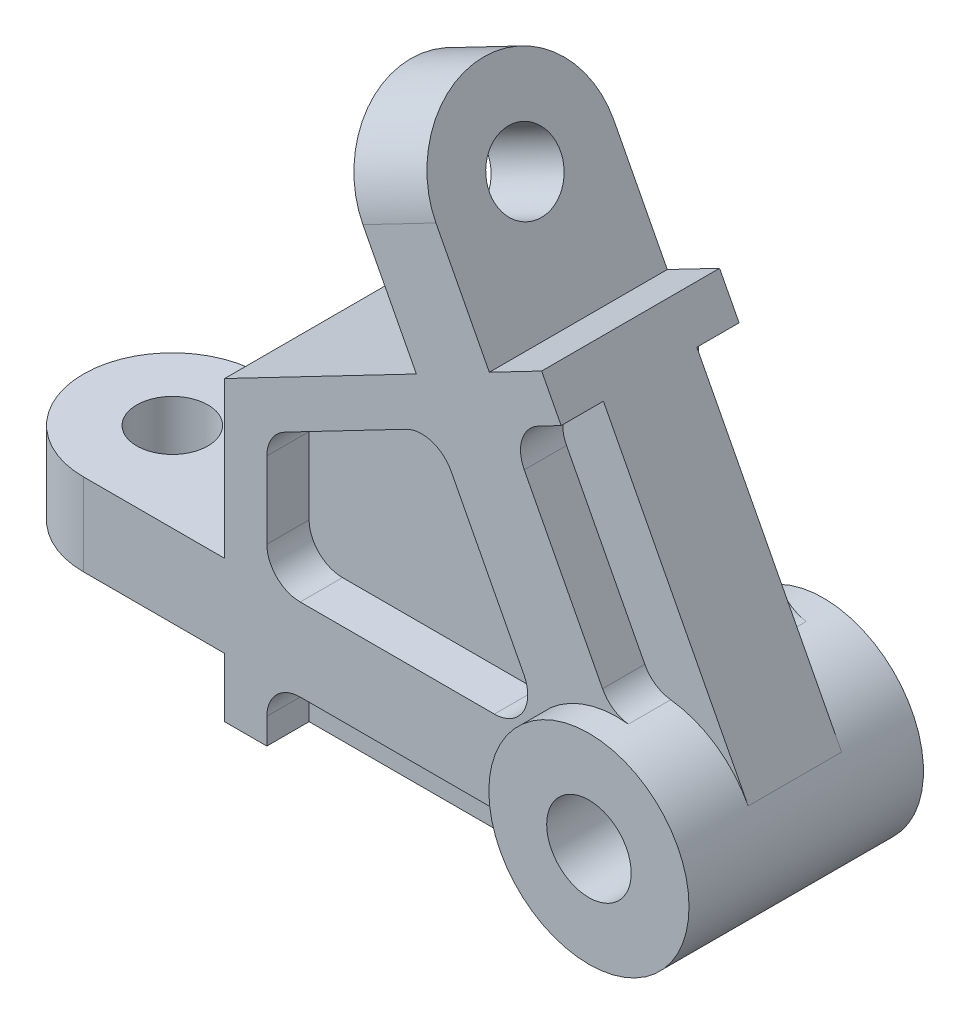
from build123d import *

# Parameters (mm, degrees)
BOSS_EXTRU_1_DEPTH      = 40
ESQUISSE2_R             = 8
ENL_V_MAT_EXTRU_1_DEPTH = 190.883457354
ESQUISSE3_R             = 8
ENL_V_MAT_EXTRU_2_DEPTH = 181.562836456
BOSS_EXTRU_2_DEPTH      = 6.35
BOSS_EXTRU_3_START      = 6.35
BOSS_EXTRU_3_DEPTH      = 6.35
ENL_V_START             = -9.5
ENL_V_MAT_EXTRU_3_DEPTH = 9.5
ENL_V_MAT_EXTRU_6_DEPTH = 9.5


with BuildPart() as part:
    # Esquisse1 → Boss.-Extru.1 (new body)
    with BuildSketch(Plane.XY):
        with BuildLine():
            ThreePointArc((-10.389343798, 19.957743747), (6.765880489, 21.458631392), (19.957743747, 10.389343798))
            Line((19.957743747, 10.389343798), (-16.981934979, 81.349806406))
            Line((-16.981934979, 81.349806406), (-28.734828519, 75.231637281))
            Line((-28.734828519, 75.231637281), (-49.975475061, 116.034539653))
            Line((-49.975475061, 116.034539653), (-58.180325268, 111.76336498))
            Line((-58.180325268, 111.76336498), (-10.389343798, 19.957743747))
        make_face()
        with BuildLine():
            ThreePointArc((-22.5, 0), (-19.23551709, 11.672398309), (-10.389343798, 19.957743747))
            Line((-10.389343798, 19.957743747), (-58.180325268, 111.76336498))
            Line((-58.180325268, 111.76336498), (-66.385175475, 107.492190308))
            Line((-66.385175475, 107.492190308), (-45.144528933, 66.689287936))
            Line((-45.144528933, 66.689287936), (-88.25, 44.25))
            Line((-88.25, 44.25), (-88.25, 9.25))
            Line((-88.25, 9.25), (-140, 9.25))
            Line((-140, 9.25), (-140, 0))
            Line((-140, 0), (-22.5, 0))
        make_face()
        with BuildLine():
            Line((-88.25, -22.560492565), (0.015421683, -22.499994715))
            ThreePointArc((0.015421683, -22.499994715), (-15.904449254, -15.915354031), (-22.5, 0))
            Line((-22.5, 0), (-140, 0))
            Line((-140, 0), (-140, -9.25))
            Line((-140, -9.25), (-88.25, -9.25))
            Line((-88.25, -9.25), (-88.25, -22.560492565))
        make_face()
        with BuildLine():
            ThreePointArc((22.5, 0), (21.855196571, 5.347932577), (19.957743747, 10.389343798))
            ThreePointArc((19.957743747, 10.389343798), (6.765880489, 21.458631392), (-10.389343798, 19.957743747))
            Line((-10.389343798, 19.957743747), (-4.386611826, 8.426602915))
            ThreePointArc((-4.386611826, 8.426602915), (4.928345953, 8.121662771), (9.5, 0))
            ThreePointArc((9.5, 0), (0, -9.5), (-9.5, 0))
            Line((-9.5, 0), (-22.5, 0))
            ThreePointArc((-22.5, 0), (-15.904449254, -15.915354031), (0.015421683, -22.499994715))
            ThreePointArc((0.015421683, -22.499994715), (15.915354031, -15.904449254), (22.5, 0))
        make_face()
        with BuildLine():
            Line((-4.386611826, 8.426602915), (-10.389343798, 19.957743747))
            ThreePointArc((-10.389343798, 19.957743747), (-19.23551709, 11.672398309), (-22.5, 0))
            Line((-22.5, 0), (-9.5, 0))
            ThreePointArc((-9.5, 0), (-8.121662771, 4.928345953), (-4.386611826, 8.426602915))
        make_face()
        with BuildLine():
            ThreePointArc((22.5, 0), (21.855196571, 5.347932577), (19.957743747, 10.389343798))
            ThreePointArc((19.957743747, 10.389343798), (6.765880489, 21.458631392), (-10.389343798, 19.957743747))
            Line((-10.389343798, 19.957743747), (-4.386611826, 8.426602915))
            ThreePointArc((-4.386611826, 8.426602915), (4.928345953, 8.121662771), (9.5, 0))
            ThreePointArc((9.5, 0), (0, -9.5), (-9.5, 0))
            Line((-9.5, 0), (-22.5, 0))
            ThreePointArc((-22.5, 0), (-15.904449254, -15.915354031), (0.015421683, -22.499994715))
            ThreePointArc((0.015421683, -22.499994715), (15.915354031, -15.904449254), (22.5, 0))
        make_face()
        with BuildLine():
            Line((-4.386611826, 8.426602915), (-10.389343798, 19.957743747))
            ThreePointArc((-10.389343798, 19.957743747), (-19.23551709, 11.672398309), (-22.5, 0))
            Line((-22.5, 0), (-9.5, 0))
            ThreePointArc((-9.5, 0), (-8.121662771, 4.928345953), (-4.386611826, 8.426602915))
        make_face()
    extrude(amount=BOSS_EXTRU_1_DEPTH)

    # Esquisse2 → Enlèv. mat.-Extru.1 (cut, through all)
    with BuildSketch(Plane(origin=(8.204850207, 4.271174672, 0), x_dir=(0, 0, -1), z_dir=(0.8870108331782228, 0.4617486132350319, 0))):
        with Locations(Location((-20, 106, 0), (0, 0, 90))):
            Circle(ESQUISSE2_R)
        with BuildLine():
            ThreePointArc((-40, 106), (-34.142135624, 120.142135624), (-20, 126))
            Line((-20, 126), (-40, 126))
            Line((-40, 126), (-40, 106))
        make_face()
        with BuildLine():
            ThreePointArc((-20, 126), (-5.857864376, 120.142135624), (0, 106))
            Line((0, 106), (0, 126))
            Line((0, 126), (-20, 126))
        make_face()
    extrude(amount=-ENL_V_MAT_EXTRU_1_DEPTH, mode=Mode.SUBTRACT)

    # Esquisse3 → Enlèv. mat.-Extru.2 (cut, through all)
    with BuildSketch(Plane(origin=(0, 9.25, 0), x_dir=(1, 0, 0), z_dir=(0, 1, 0))):
        with BuildLine():
            ThreePointArc((-140, -20), (-134.142135624, -5.857864376), (-120, 0))
            Line((-120, 0), (-140, 0))
            Line((-140, 0), (-140, -20))
        make_face()
        with BuildLine():
            ThreePointArc((-120, -40), (-134.142135624, -34.142135624), (-140, -20))
            Line((-140, -20), (-140, -40))
            Line((-140, -40), (-120, -40))
        make_face()
        with Locations(Location((-120, -20, 0), (0, 0, 180))):
            Circle(ESQUISSE3_R)
    extrude(amount=-ENL_V_MAT_EXTRU_2_DEPTH, mode=Mode.SUBTRACT)

    # Esquisse4 → Boss.-Extru.2 (add)
    with BuildSketch(Plane.XY.offset(40)):
        with BuildLine():
            ThreePointArc((22.5, 0), (21.855196571, 5.347932577), (19.957743747, 10.389343798))
            ThreePointArc((19.957743747, 10.389343798), (6.765880489, 21.458631392), (-10.389343798, 19.957743747))
            Line((-10.389343798, 19.957743747), (-4.386611826, 8.426602915))
            ThreePointArc((-4.386611826, 8.426602915), (4.928345953, 8.121662771), (9.5, 0))
            ThreePointArc((9.5, 0), (0, -9.5), (-9.5, 0))
            Line((-9.5, 0), (-22.5, 0))
            ThreePointArc((-22.5, 0), (-15.904449254, -15.915354031), (0.015421683, -22.499994715))
            ThreePointArc((0.015421683, -22.499994715), (15.915354031, -15.904449254), (22.5, 0))
        make_face()
        with BuildLine():
            ThreePointArc((22.5, 0), (21.855196571, 5.347932577), (19.957743747, 10.389343798))
            ThreePointArc((19.957743747, 10.389343798), (6.765880489, 21.458631392), (-10.389343798, 19.957743747))
            Line((-10.389343798, 19.957743747), (-4.386611826, 8.426602915))
            ThreePointArc((-4.386611826, 8.426602915), (4.928345953, 8.121662771), (9.5, 0))
            ThreePointArc((9.5, 0), (0, -9.5), (-9.5, 0))
            Line((-9.5, 0), (-22.5, 0))
            ThreePointArc((-22.5, 0), (-15.904449254, -15.915354031), (0.015421683, -22.499994715))
            ThreePointArc((0.015421683, -22.499994715), (15.915354031, -15.904449254), (22.5, 0))
        make_face()
        with BuildLine():
            Line((-4.386611826, 8.426602915), (-10.389343798, 19.957743747))
            ThreePointArc((-10.389343798, 19.957743747), (-19.23551709, 11.672398309), (-22.5, 0))
            Line((-22.5, 0), (-9.5, 0))
            ThreePointArc((-9.5, 0), (-8.121662771, 4.928345953), (-4.386611826, 8.426602915))
        make_face()
    extrude(amount=BOSS_EXTRU_2_DEPTH)

    # Esquisse5 → Boss.-Extru.3 (add)
    with BuildSketch(Plane(origin=(0, 0, 0), x_dir=(-1, 0, 0), z_dir=(0, 0, -1)).offset(BOSS_EXTRU_3_START)):
        with BuildLine():
            ThreePointArc((10.389343798, 19.957743747), (-6.765880489, 21.458631392), (-19.957743747, 10.389343798))
            ThreePointArc((-19.957743747, 10.389343798), (-19.239516139, -11.665805533), (-0.015421683, -22.499994715))
            ThreePointArc((-0.015421683, -22.499994715), (15.904449254, -15.915354031), (22.5, 0))
            Line((22.5, 0), (9.5, 0))
            ThreePointArc((9.5, 0), (-8.121662771, -4.928345953), (4.386611826, 8.426602915))
            Line((4.386611826, 8.426602915), (10.389343798, 19.957743747))
        make_face()
        with BuildLine():
            ThreePointArc((22.5, 0), (19.23551709, 11.672398309), (10.389343798, 19.957743747))
            Line((10.389343798, 19.957743747), (4.386611826, 8.426602915))
            ThreePointArc((4.386611826, 8.426602915), (8.121662771, 4.928345953), (9.5, 0))
            Line((9.5, 0), (22.5, 0))
        make_face()
        with BuildLine():
            ThreePointArc((10.389343798, 19.957743747), (-6.765880489, 21.458631392), (-19.957743747, 10.389343798))
            ThreePointArc((-19.957743747, 10.389343798), (-19.239516139, -11.665805533), (-0.015421683, -22.499994715))
            ThreePointArc((-0.015421683, -22.499994715), (15.904449254, -15.915354031), (22.5, 0))
            Line((22.5, 0), (9.5, 0))
            ThreePointArc((9.5, 0), (-8.121662771, -4.928345953), (4.386611826, 8.426602915))
            Line((4.386611826, 8.426602915), (10.389343798, 19.957743747))
        make_face()
    extrude(amount=-BOSS_EXTRU_3_DEPTH)

    # Esquisse6 → Enlèv. mat.-Extru.3 (cut)
    with BuildSketch(Plane.XY.offset(40).offset(ENL_V_START)):
        with BuildLine():
            Line((19.957743747, 10.389343798), (-12.595323154, 72.923203491))
            Line((-12.595323154, 72.923203491), (-17.695635444, 70.268148965))
            ThreePointArc((-17.695635444, 70.268148965), (-21.385397976, 65.870861212), (-20.885102094, 60.152453117))
            Line((-20.885102094, 60.152453117), (-3.287380782, 26.347545001))
            ThreePointArc((-3.287380782, 26.347545001), (-0.879642567, 23.627512536), (2.52390035, 22.3579947))
            ThreePointArc((2.52390035, 22.3579947), (12.734529101, 18.549441193), (19.957743747, 10.389343798))
        make_face()
        with BuildLine():
            Line((-78.75, -22.553981187), (0.015421683, -22.499994715))
            ThreePointArc((0.015421683, -22.499994715), (-10.566597122, -19.864466398), (-18.666376021, -12.5625))
            ThreePointArc((-18.666376021, -12.5625), (-21.364033316, -10.129718662), (-24.888501361, -9.25))
            Line((-24.888501361, -9.25), (-71.25, -9.25))
            ThreePointArc((-71.25, -9.25), (-76.553300859, -11.446699141), (-78.75, -16.75))
            Line((-78.75, -16.75), (-78.75, -22.553981187))
        make_face()
        with BuildLine():
            Line((-20.950564458, 20.213114599), (-37.294802508, 51.610103772))
            ThreePointArc((-37.294802508, 51.610103772), (-41.69209026, 55.299866303), (-47.410498356, 54.799570422))
            Line((-47.410498356, 54.799570422), (-74.713114599, 40.586728011))
            ThreePointArc((-74.713114599, 40.586728011), (-77.66183903, 37.824946199), (-78.75, 33.934146763))
            Line((-78.75, 33.934146763), (-78.75, 16.75))
            ThreePointArc((-78.75, 16.75), (-76.553300859, 11.446699141), (-71.25, 9.25))
            Line((-71.25, 9.25), (-27.603145707, 9.25))
            ThreePointArc((-27.603145707, 9.25), (-21.191306677, 12.859200564), (-20.950564458, 20.213114599))
        make_face()
    extrude(amount=ENL_V_MAT_EXTRU_3_DEPTH, mode=Mode.SUBTRACT)

    # Esquisse9 → Enlèv. mat.-Extru.6 (cut)
    with BuildSketch(Plane(origin=(0, 0, 0), x_dir=(-1, 0, 0), z_dir=(0, 0, -1))):
        with BuildLine():
            ThreePointArc((-19.957743747, 10.389343798), (-12.734529101, 18.549441193), (-2.52390035, 22.3579947))
            ThreePointArc((-2.52390035, 22.3579947), (0.879642567, 23.627512536), (3.287380782, 26.347545001))
            Line((3.287380782, 26.347545001), (20.885102094, 60.152453117))
            ThreePointArc((20.885102094, 60.152453117), (21.385397976, 65.870861212), (17.695635444, 70.268148965))
            Line((17.695635444, 70.268148965), (12.595323154, 72.923203491))
            Line((12.595323154, 72.923203491), (-19.957743747, 10.389343798))
        make_face()
        with BuildLine():
            Line((47.410498356, 54.799570422), (74.713114599, 40.586728011))
            ThreePointArc((74.713114599, 40.586728011), (77.66183903, 37.824946199), (78.75, 33.934146763))
            Line((78.75, 33.934146763), (78.75, 16.75))
            ThreePointArc((78.75, 16.75), (76.553300859, 11.446699141), (71.25, 9.25))
            Line((71.25, 9.25), (27.603145707, 9.25))
            ThreePointArc((27.603145707, 9.25), (21.191306677, 12.859200564), (20.950564458, 20.213114599))
            Line((20.950564458, 20.213114599), (37.294802508, 51.610103772))
            ThreePointArc((37.294802508, 51.610103772), (41.69209026, 55.299866303), (47.410498356, 54.799570422))
        make_face()
        with BuildLine():
            Line((71.25, -9.25), (24.888501361, -9.25))
            ThreePointArc((24.888501361, -9.25), (21.364033316, -10.129718662), (18.666376021, -12.5625))
            ThreePointArc((18.666376021, -12.5625), (10.566597122, -19.864466398), (-0.015421683, -22.499994715))
            Line((-0.015421683, -22.499994715), (78.75, -22.553981187))
            Line((78.75, -22.553981187), (78.75, -16.75))
            ThreePointArc((78.75, -16.75), (76.553300859, -11.446699141), (71.25, -9.25))
        make_face()
    extrude(amount=-ENL_V_MAT_EXTRU_6_DEPTH, mode=Mode.SUBTRACT)


solid = part.part
